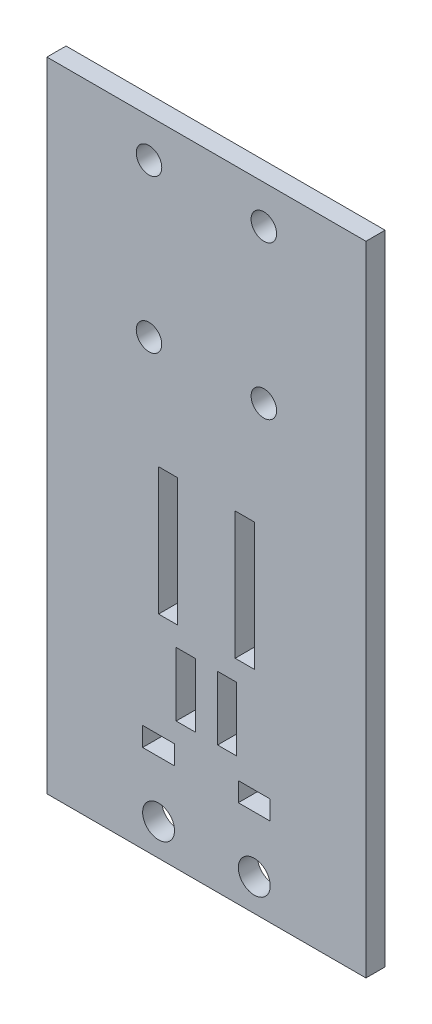
from build123d import *

# Parameters (mm, degrees)
SKETCH1_W           = 50
SKETCH1_H           = 100
SKETCH1_R           = 2
SKETCH1_R_2         = 2.5
SKETCH1_W_2         = 3
SKETCH1_H_2         = 20
BOSS_EXTRUDE1_DEPTH = 3
SKETCH2_W           = 3
SKETCH2_H           = 10
CUT_EXTRUDE1_DEPTH  = 10
SKETCH3_W           = 5
SKETCH3_H           = 3
CUT_EXTRUDE2_DEPTH  = 56.982140009


with BuildPart() as part:
    # Sketch1 → Boss-Extrude1 (new body)
    with BuildSketch(Plane.XY):
        Rectangle(SKETCH1_W, SKETCH1_H)
        with Locations((-9, 44)):
            Circle(SKETCH1_R, mode=Mode.SUBTRACT)
        with Locations(Location((9, 44, 0), (0, 0, 180))):
            Circle(SKETCH1_R, mode=Mode.SUBTRACT)
        with Locations(Location((-9, 20, 0), (0, 0, 180))):
            Circle(SKETCH1_R, mode=Mode.SUBTRACT)
        with Locations((9, 20)):
            Circle(SKETCH1_R, mode=Mode.SUBTRACT)
        with Locations((-7.5, -45)):
            Circle(SKETCH1_R_2, mode=Mode.SUBTRACT)
        with Locations(Location((7.5, -45, 0), (0, 0, 180))):
            Circle(SKETCH1_R_2, mode=Mode.SUBTRACT)
        with Locations((6, -6.851771234)):
            Rectangle(SKETCH1_W_2, SKETCH1_H_2, mode=Mode.SUBTRACT)
        with Locations((-6, -6.851771234)):
            Rectangle(SKETCH1_W_2, SKETCH1_H_2, mode=Mode.SUBTRACT)
    extrude(amount=BOSS_EXTRUDE1_DEPTH)

    # Sketch2 → Cut-Extrude1 (cut)
    with BuildSketch(Plane.XY.offset(3)):
        with Locations((3.25, -25)):
            Rectangle(SKETCH2_W, SKETCH2_H)
        with Locations((-3.25, -25)):
            Rectangle(SKETCH2_W, SKETCH2_H)
    extrude(amount=-CUT_EXTRUDE1_DEPTH, mode=Mode.SUBTRACT)

    # Sketch3 → Cut-Extrude2 (cut, through all)
    with BuildSketch(Plane.XY.offset(3)):
        with Locations((-7.5, -34.709613659)):
            Rectangle(SKETCH3_W, SKETCH3_H)
        with Locations((7.5, -34.709613659)):
            Rectangle(SKETCH3_W, SKETCH3_H)
    extrude(amount=-CUT_EXTRUDE2_DEPTH, mode=Mode.SUBTRACT)


solid = part.part
